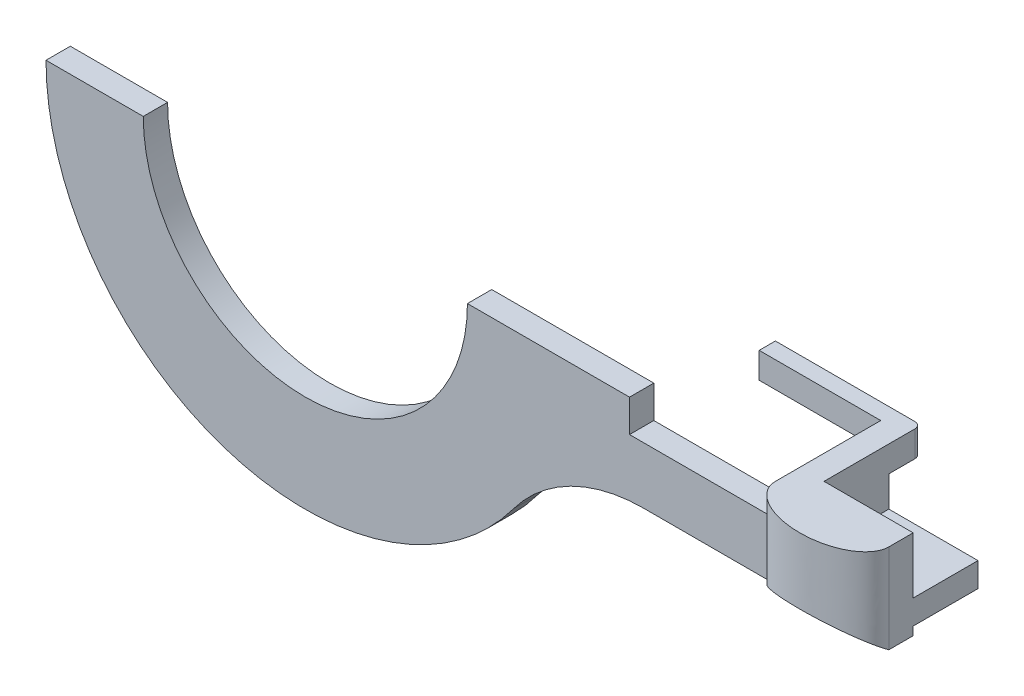
from build123d import *

# Parameters (mm, degrees)
ESQUISSE1_R                  = 5
ESQUISSE1_W                  = 4.5
ESQUISSE1_H                  = 2
BASE_EXTRUSION_DEPTH         = 0.75
BOSS_EXTRU_1_DEPTH           = 2.75
BOSS_EXTRU_2_DEPTH           = 2
ESQUISSE4_W                  = 0.75
ESQUISSE4_H                  = 1.6
BOSS_EXTRU_3_DEPTH           = 0.5
ESQUISSE5_W                  = 0.75
ESQUISSE5_H                  = 1.6
ESQUISSE5_W_2                = 3.75
BOSS_EXTRU_4_DEPTH           = 0.5
ENL_V_MAT_EXTRU_1_DEPTH      = 5
CONG_1_R                     = 0.2
ENL_V_MAT_EXTRU_2_DEPTH      = 20.924858936
ENL_V_MAT_EXTRU_2_DEPTH_BACK = 20.924858936
ESQUISSE8_W                  = 35.088293703
ESQUISSE8_H                  = 17.712514744


with BuildPart() as part:
    # Esquisse1 → Base-Extrusion (new body)
    with BuildSketch(Plane.XY):
        with BuildLine():
            Line((10.437312873, -2.75), (18, -2.75))
            Line((18, -2.75), (18, 2.75))
            Line((18, 2.75), (10.437312873, 2.75))
            ThreePointArc((10.437312873, 2.75), (8.190520287, 3.283242443), (6.422961768, 4.769230769))
            ThreePointArc((6.422961768, 4.769230769), (-8, 0), (6.422961768, -4.769230769))
            ThreePointArc((6.422961768, -4.769230769), (8.190520287, -3.283242443), (10.437312873, -2.75))
        make_face()
        Circle(ESQUISSE1_R, mode=Mode.SUBTRACT)
        with Locations((12.25, 0)):
            Rectangle(ESQUISSE1_W, ESQUISSE1_H, mode=Mode.SUBTRACT)
    extrude(amount=BASE_EXTRUSION_DEPTH)

    # Esquisse2 → Boss.-Extru.1 (add, symmetric)
    with BuildSketch(Plane(origin=(0, 0, 0), x_dir=(1, 0, 0), z_dir=(0, 1, 0))):
        with BuildLine():
            Line((14.5, -0.75), (18, -0.75))
            add(Edge.make_bspline(
                [(14.5, -0.75), (14.5, -1.75), (16.25, -1.75), (18, -1.75), (18, -0.75)],
                knots=[3.141592654, 3.141592654, 3.141592654, 4.71238898, 4.71238898, 6.283185307, 6.283185307, 6.283185307], degree=2, weights=[1, 0.707106781, 1, 0.707106781, 1]))
        make_face()
    extrude(amount=BOSS_EXTRU_1_DEPTH, both=True)

    # Esquisse3 → Boss.-Extru.2 (add)
    with BuildSketch(Plane(origin=(0, 0, 0), x_dir=(-1, 0, 0), z_dir=(0, 0, -1))):
        Polygon((-18, 2.508740879), (-14.5, 2.508740879), (-14.5, -2.491259121), (-18, -2.491259121), (-18, -1.741259121), (-15.25, -1.741259121), (-15.25, 1.758740879), (-18, 1.758740879), align=None)
    extrude(amount=BOSS_EXTRU_2_DEPTH)

    # Esquisse4 → Boss.-Extru.3 (add)
    with BuildSketch(Plane(origin=(0, 0, -2), x_dir=(-1, 0, 0), z_dir=(0, 0, -1))):
        with Locations((-14.875, 0)):
            Rectangle(ESQUISSE4_W, ESQUISSE4_H)
    extrude(amount=BOSS_EXTRU_3_DEPTH)

    # Esquisse5 → Boss.-Extru.4 (add)
    with BuildSketch(Plane(origin=(0, 0, -2.5), x_dir=(-1, 0, 0), z_dir=(0, 0, -1))):
        with Locations((-14.875, 0)):
            Rectangle(ESQUISSE5_W, ESQUISSE5_H)
        with Locations((-12.625, 0)):
            Rectangle(ESQUISSE5_W_2, ESQUISSE5_H)
    extrude(amount=BOSS_EXTRU_4_DEPTH)

    # Esquisse6 → Enlèv. mat.-Extru.1 (cut)
    with BuildSketch(Plane(origin=(18, 0, 0), x_dir=(0, 0, -1), z_dir=(1, 0, 0))):
        Polygon((-2.292509323, 1.649738381), (-2.292509323, -1.649738381), (-0.75, -2.75), (-0.75, -3.504060129), (-3.255228029, -3.504060129), (-3.255228029, 3.504060129), (-0.75, 3.504060129), (-0.75, 2.75), align=None)
    extrude(amount=-ENL_V_MAT_EXTRU_1_DEPTH, mode=Mode.SUBTRACT)

    # Congé1
    cong_1_edges = [part.edges().sort_by_distance(p)[0] for p in [
        (15.25, 0, -3),
    ]]
    fillet(cong_1_edges, radius=CONG_1_R)

    # Esquisse8 → Enlèv. mat.-Extru.2 (cut, two sides: drawn at the far end of the back side and taken through both)
    with BuildSketch(Plane(origin=(0, 0, 0), x_dir=(-1, 0, 0), z_dir=(0, 0, -1)).offset(-ENL_V_MAT_EXTRU_2_DEPTH_BACK)):
        with Locations((-5.432124142, 8.856257372)):
            Rectangle(ESQUISSE8_W, ESQUISSE8_H)
    extrude(amount=ENL_V_MAT_EXTRU_2_DEPTH + ENL_V_MAT_EXTRU_2_DEPTH_BACK, mode=Mode.SUBTRACT)


solid = part.part
